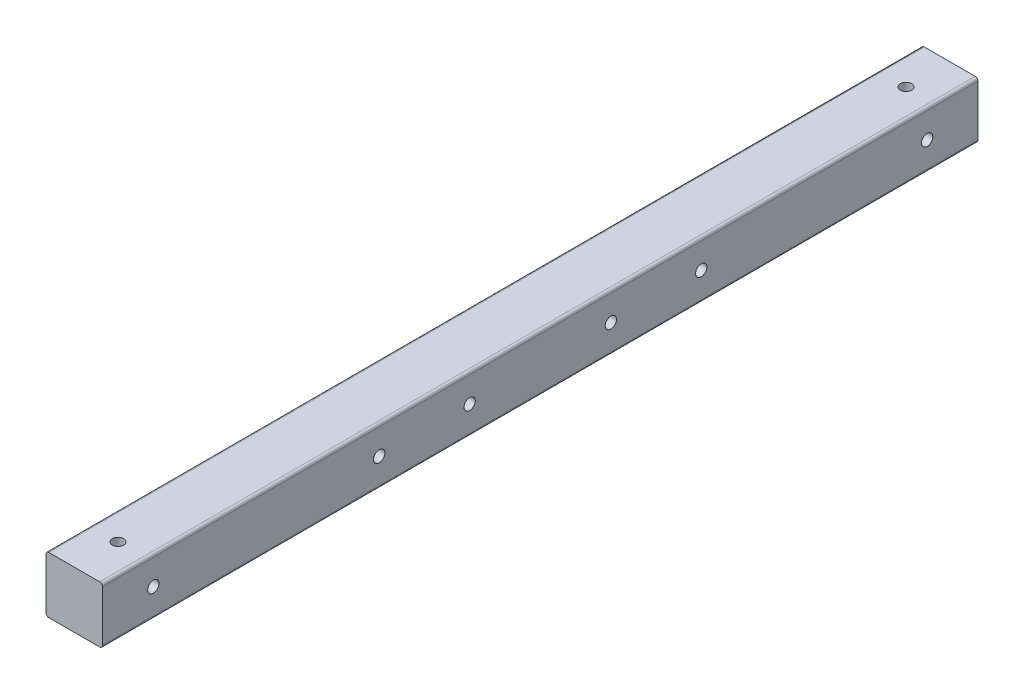
from build123d import *

# Parameters (mm, degrees)
SKETCH_1_W          = 20
SKETCH_1_H          = 20
EXTRUDE_1_DEPTH     = 310
FILLET_1_R          = 1
SKETCH_2_R          = 2
CUT_EXTRUDE_1_DEPTH = 310
SKETCH_3_R          = 2
CUT_EXTRUDE_2_DEPTH = 20


with BuildPart() as part:
    # 草图1 → 凸台-拉伸1 (new body)
    with BuildSketch(Plane.XY):
        with Locations((10, 10)):
            Rectangle(SKETCH_1_W, SKETCH_1_H)
    extrude(amount=EXTRUDE_1_DEPTH)

    # 圆角1
    fillet_1_edges = [part.edges().sort_by_distance(p)[0] for p in [
        (0, 20, 155),
        (20, 20, 155),
        (20, 0, 155),
        (0, 0, 155),
    ]]
    fillet(fillet_1_edges, radius=FILLET_1_R)

    # 草图2 → 切除-拉伸1 (cut)
    with BuildSketch(Plane.ZY):
        with Locations((98, 10)):
            Circle(SKETCH_2_R)
        with Locations((212, 10)):
            Circle(SKETCH_2_R)
        with Locations((130, 10)):
            Circle(SKETCH_2_R)
        with Locations((180, 10)):
            Circle(SKETCH_2_R)
        with Locations((18, 10)):
            Circle(SKETCH_2_R)
        with Locations((292, 10)):
            Circle(SKETCH_2_R)
    extrude(amount=-CUT_EXTRUDE_1_DEPTH, mode=Mode.SUBTRACT)

    # 草图3 → 切除-拉伸2 (cut)
    with BuildSketch(Plane.XZ):
        with Locations(Location((10, 15.5, 0), (0, 0, 270))):
            Circle(SKETCH_3_R)
        with Locations(Location((10, 294.5, 0), (0, 0, 270))):
            Circle(SKETCH_3_R)
    extrude(amount=-CUT_EXTRUDE_2_DEPTH, mode=Mode.SUBTRACT)


solid = part.part
